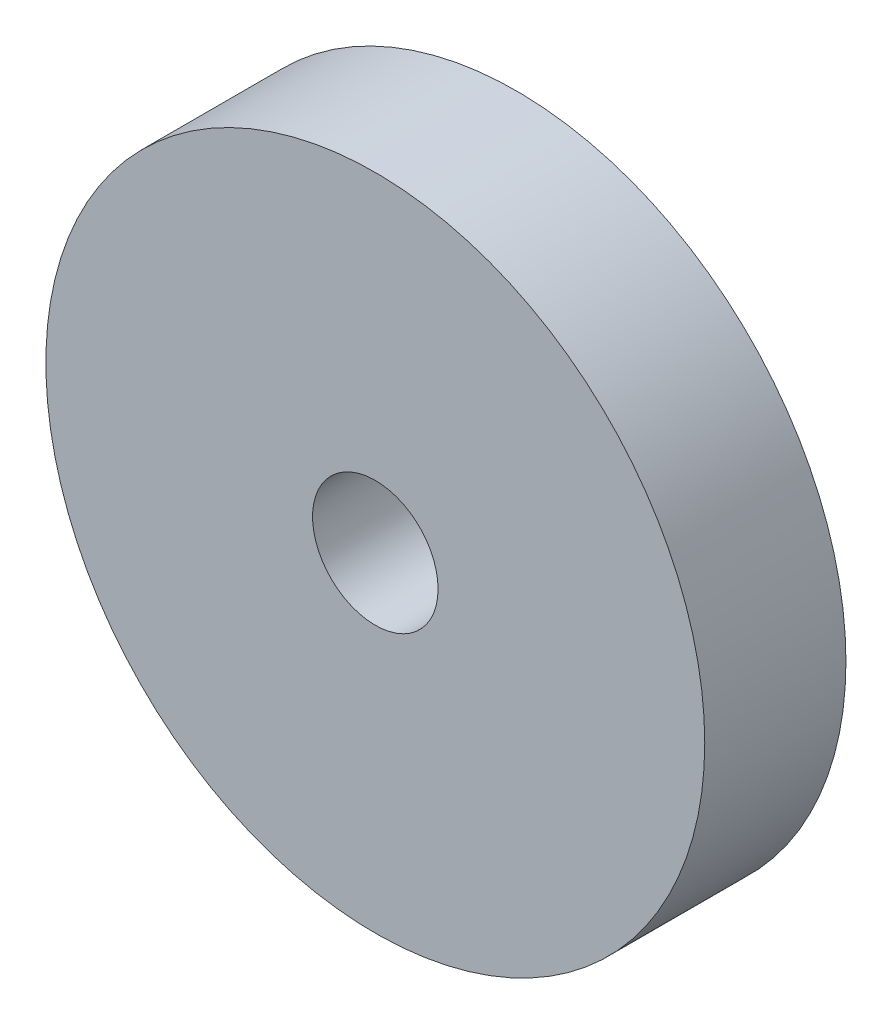
from build123d import *

# Parameters (mm, degrees)
SKETCH_1_R      = 42
SKETCH_1_R_2    = 8
EXTRUDE_1_DEPTH = 18


with BuildPart() as part:
    # 草图1 → 凸台-拉伸1 (new body)
    with BuildSketch(Plane.XY):
        Circle(SKETCH_1_R)
        Circle(SKETCH_1_R_2, mode=Mode.SUBTRACT)
    extrude(amount=EXTRUDE_1_DEPTH)


solid = part.part
